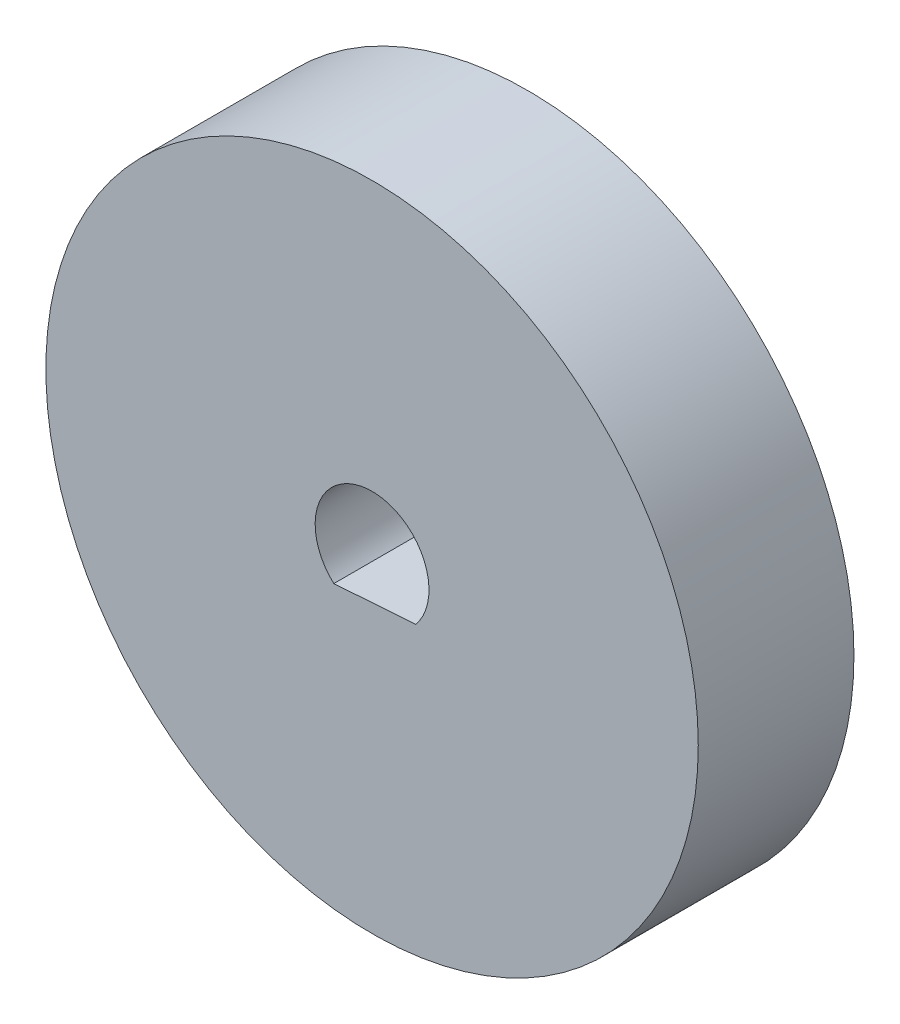
from build123d import *

# Parameters (mm, degrees)
SKETCH1_R           = 11.176
BOSS_EXTRUDE1_DEPTH = 5.334
CUT_EXTRUDE1_DEPTH  = 23.233605605


with BuildPart() as part:
    # Sketch1 → Boss-Extrude1 (new body)
    with BuildSketch(Plane.XY):
        with Locations((0, 7.2896082)):
            Circle(SKETCH1_R)
    extrude(amount=BOSS_EXTRUDE1_DEPTH)

    # Sketch2 → Cut-Extrude1 (cut, through all)
    with BuildSketch(Plane(origin=(0, 0, 0), x_dir=(-1, 0, 0), z_dir=(0, 0, -1))):
        with BuildLine():
            ThreePointArc((1.95, 7.2896082), (-0.664736598, 9.122809022), (-1.496795133, 6.039766478))
            Line((-1.496795133, 6.039766478), (1.310766563, 5.845866181))
            ThreePointArc((1.310766563, 5.845866181), (1.783044419, 6.50014471), (1.95, 7.2896082))
        make_face()
    extrude(amount=-CUT_EXTRUDE1_DEPTH, mode=Mode.SUBTRACT)


solid = part.part
